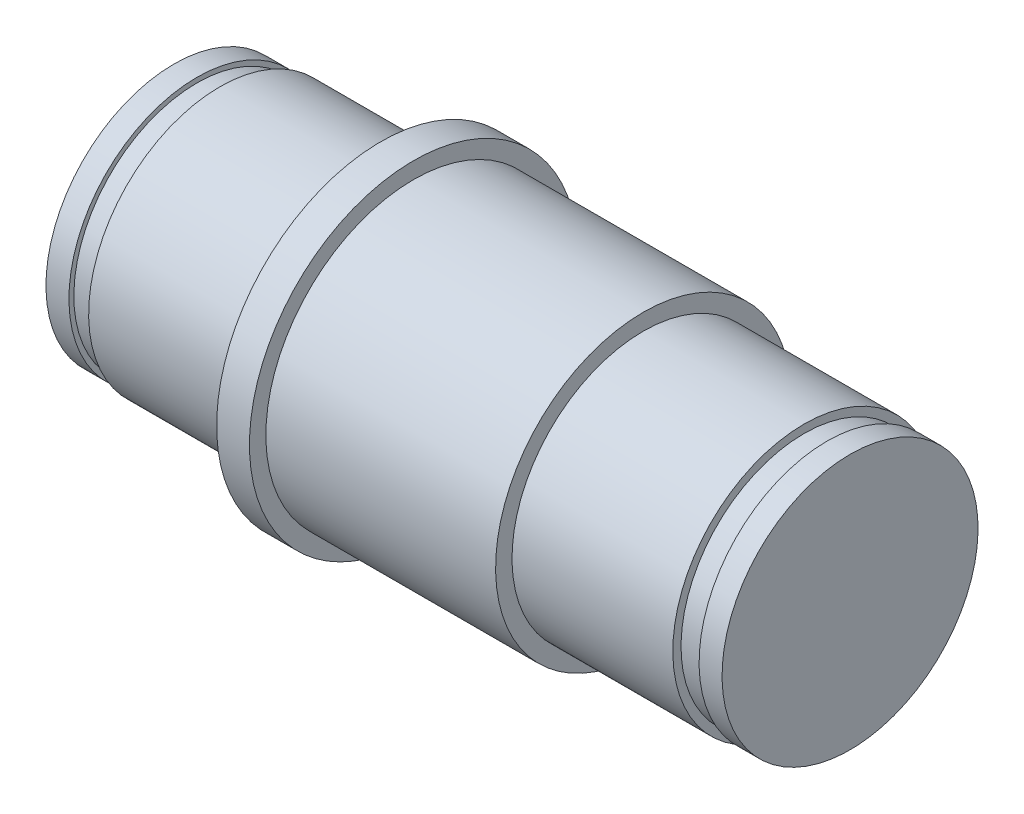
from build123d import *

# Parameters (mm, degrees)
SKETCH3_W = 1
SKETCH3_H = 0.5


with BuildPart() as part:
    # Sketch1 → Revolve1 (revolve)
    with BuildSketch(Plane.XY):
        Polygon((10.3, 0), (-10.3, 0), (-10.3, 3.9), (-9.6, 3.9), (-9.6, 3.75), (-8.9, 3.75), (-8.9, 4), (-4, 4), (-4, 4.5), (4, 4.5), (4, 4), (8.9, 4), (8.9, 3.75), (9.6, 3.75), (9.6, 3.9), (10.3, 3.9), align=None)
    revolve(axis=Axis((15.691805076, 0, 0), (-1, 0, 0)))

    # Sketch3 → Revolve2 (revolve)
    with BuildSketch(Plane.XY):
        with Locations((-3.5, 4.75)):
            Rectangle(SKETCH3_W, SKETCH3_H)
    revolve(axis=Axis((0, 0, 0), (-1, 0, 0)))


solid = part.part
